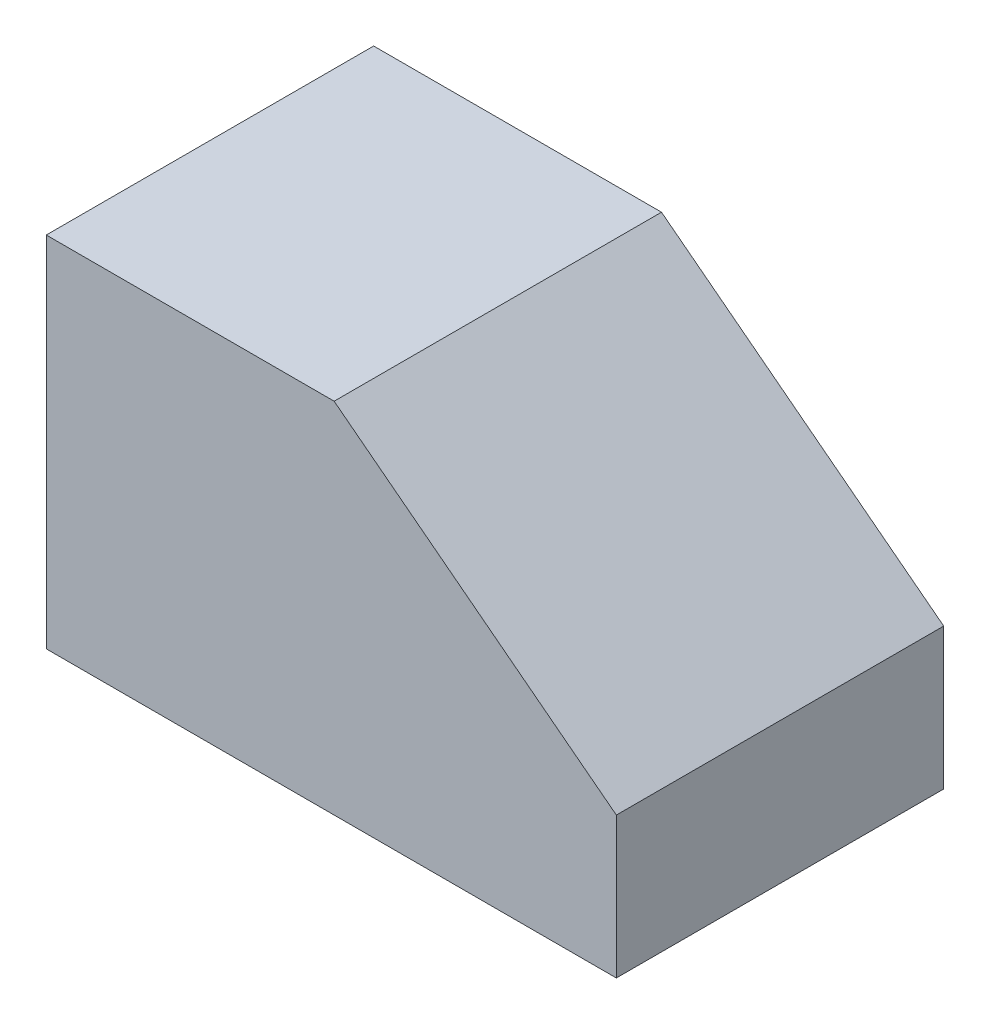
from build123d import *

# Parameters (mm, degrees)
BOSS_EXTRUDE1_DEPTH = 29


with BuildPart() as part:
    # Sketch1 → Boss-Extrude1 (new, symmetric)
    with BuildSketch(Plane.XY):
        Polygon((0, 0), (101, 0), (101, 25), (51, 63.5), (0, 63.5), align=None)
    extrude(amount=BOSS_EXTRUDE1_DEPTH, both=True)


solid = part.part
